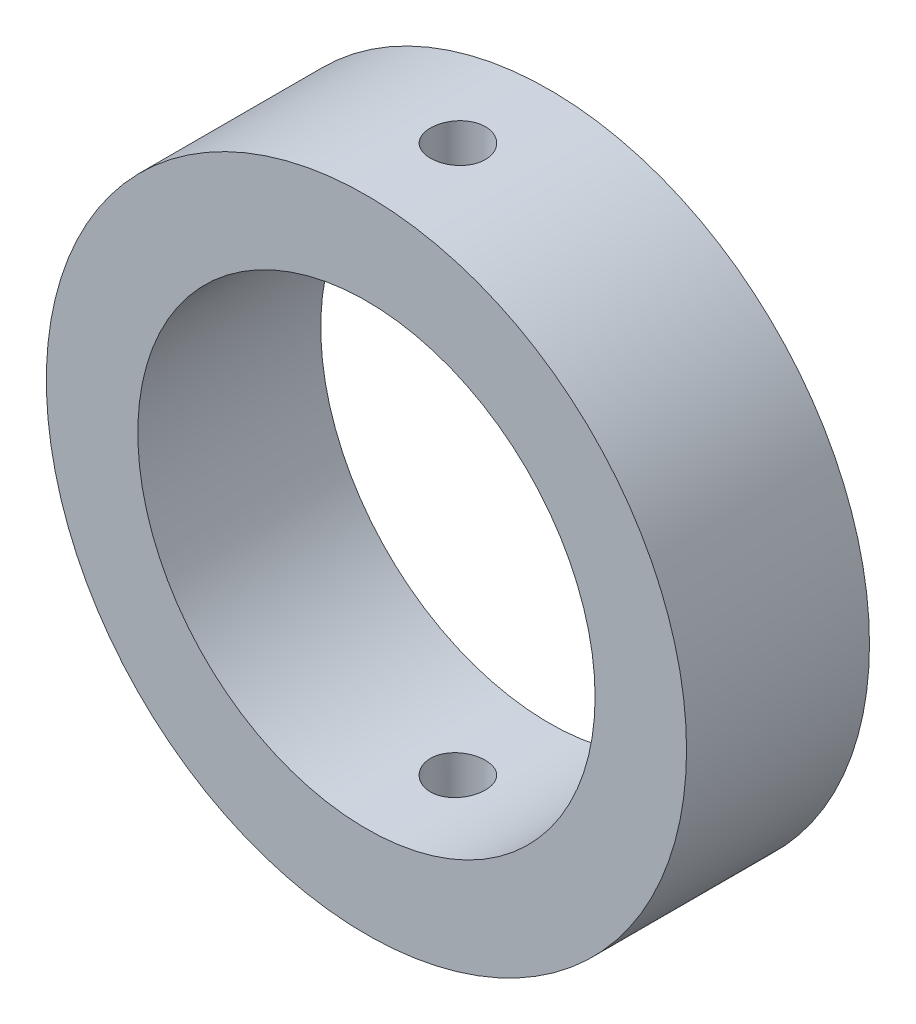
from build123d import *

# Parameters (mm, degrees)
SKETCH1_R               = 350
SKETCH1_R_2             = 250
BOSS_EXTRUDE1_DEPTH     = 200
CUT_EXTRUDE1_DEPTH      = 534.853912602
CUT_EXTRUDE1_DEPTH_BACK = 534.853912602
SKETCH2_R               = 30


with BuildPart() as part:
    # Sketch1 → Boss-Extrude1 (new body)
    with BuildSketch(Plane.XY):
        Circle(SKETCH1_R)
        Circle(SKETCH1_R_2, mode=Mode.SUBTRACT)
    extrude(amount=BOSS_EXTRUDE1_DEPTH)

    # Sketch2 → Cut-Extrude1 (cut, two sides: drawn at the far end of the back side and taken through both)
    with BuildSketch(Plane(origin=(0, 0, 0), x_dir=(1, 0, 0), z_dir=(0, 1, 0)).offset(-CUT_EXTRUDE1_DEPTH_BACK)):
        with Locations(Location((0, -100, 0), (0, 0, 270))):
            Circle(SKETCH2_R)
    extrude(amount=CUT_EXTRUDE1_DEPTH + CUT_EXTRUDE1_DEPTH_BACK, mode=Mode.SUBTRACT)


solid = part.part
